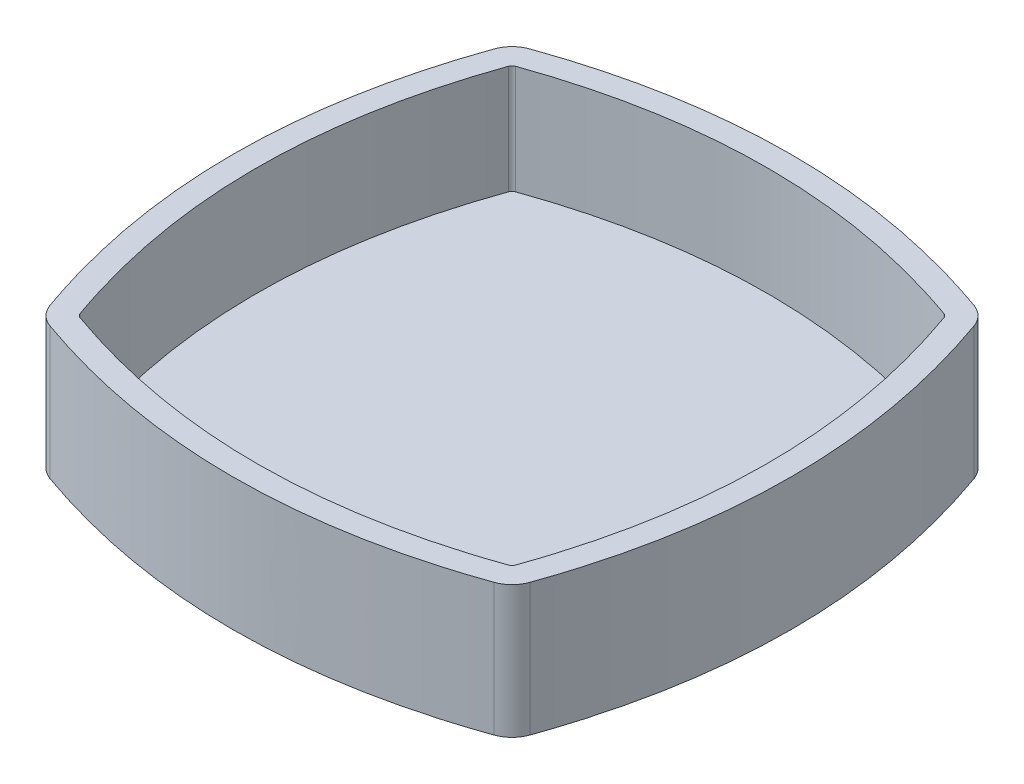
from build123d import *

# Parameters (mm, degrees)
BOSS_EXTRUDE1_DEPTH = 14.2875
FILLET1_R           = 3.175
SHELL1_T            = -2.54


with BuildPart() as part:
    # Sketch1 → Boss-Extrude1 (new body)
    with BuildSketch(Plane(origin=(0, 0, 0), x_dir=(1, 0, 0), z_dir=(0, 1, 0))):
        with BuildLine():
            Line((0, 0), (-30.1625, 0))
            add(Edge.make_bspline(
                [(-30.1625, 0), (-30.1625, -12.7), (-25.4, -25.4)],
                knots=[0.5, 0.5, 0.5, 1, 1, 1], degree=2))
            add(Edge.make_bspline(
                [(-25.4, -25.4), (-12.7, -30.1625), (0, -30.1625)],
                knots=[0, 0, 0, 0.5, 0.5, 0.5], degree=2))
            Line((0, -30.1625), (0, 0))
        make_face()
        with BuildLine():
            add(Edge.make_bspline(
                [(-25.4, 25.4), (-30.1625, 12.7), (-30.1625, 0)],
                knots=[0, 0, 0, 0.5, 0.5, 0.5], degree=2))
            Line((-30.1625, 0), (0, 0))
            Line((0, 0), (0, 30.1625))
            add(Edge.make_bspline(
                [(-25.4, 25.4), (-12.7, 30.1625), (0, 30.1625)],
                knots=[0, 0, 0, 0.5, 0.5, 0.5], degree=2))
        make_face()
        with BuildLine():
            Line((0, 30.1625), (0, 0))
            Line((0, 0), (30.1625, 0))
            add(Edge.make_bspline(
                [(25.4, 25.4), (30.1625, 12.7), (30.1625, 0)],
                knots=[0, 0, 0, 0.5, 0.5, 0.5], degree=2))
            add(Edge.make_bspline(
                [(0, 30.1625), (12.7, 30.1625), (25.4, 25.4)],
                knots=[0.5, 0.5, 0.5, 1, 1, 1], degree=2))
        make_face()
        with BuildLine():
            Line((30.1625, 0), (0, 0))
            Line((0, 0), (0, -30.1625))
            add(Edge.make_bspline(
                [(0, -30.1625), (12.7, -30.1625), (25.4, -25.4)],
                knots=[0.5, 0.5, 0.5, 1, 1, 1], degree=2))
            add(Edge.make_bspline(
                [(30.1625, 0), (30.1625, -12.7), (25.4, -25.4)],
                knots=[0.5, 0.5, 0.5, 1, 1, 1], degree=2))
        make_face()
    extrude(amount=BOSS_EXTRUDE1_DEPTH)

    # Fillet1
    fillet1_edges = [part.edges().sort_by_distance(p)[0] for p in [
        (-25.4, 7.14375, -25.4),
        (25.4, 7.14375, -25.4),
        (-25.4, 7.14375, 25.4),
        (25.4, 7.14375, 25.4),
    ]]
    fillet(fillet1_edges, radius=FILLET1_R)

    # Shell1
    shell1_openings = [part.faces().sort_by_distance(p)[0] for p in [
        (0, 14.2875, 0),
    ]]
    offset(amount=SHELL1_T, openings=shell1_openings, kind=Kind.INTERSECTION)


solid = part.part
